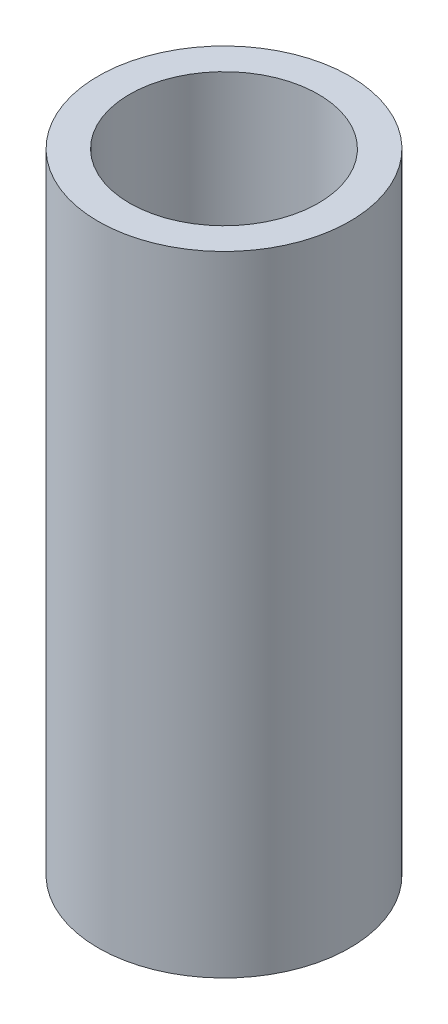
from build123d import *

# Parameters (mm, degrees)
SKETCH_1_R      = 2
SKETCH_1_R_2    = 1.5
EXTRUDE_1_DEPTH = 10


with BuildPart() as part:
    # 草图1 → 凸台-拉伸1 (new body)
    with BuildSketch(Plane(origin=(0, 0, 0), x_dir=(1, 0, 0), z_dir=(0, 1, 0))):
        with Locations(Location((0, 0, 0), (0, 0, 270))):
            Circle(SKETCH_1_R)
        with Locations(Location((0, 0, 0), (0, 0, 270))):
            Circle(SKETCH_1_R_2, mode=Mode.SUBTRACT)
    extrude(amount=EXTRUDE_1_DEPTH)


solid = part.part
